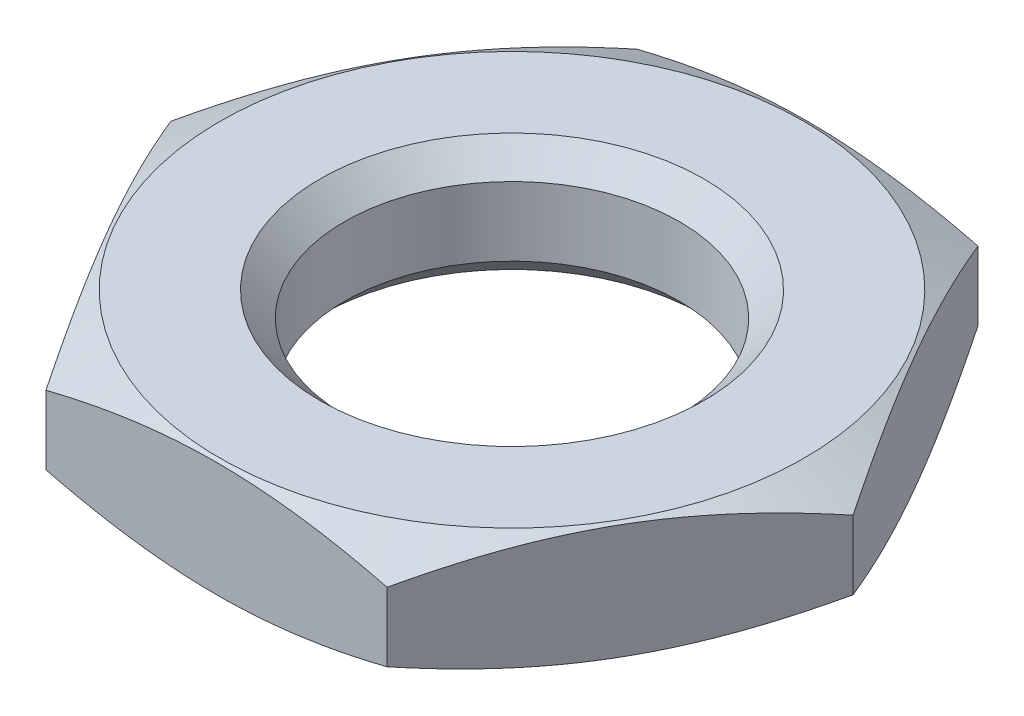
from build123d import *

# Parameters (mm, degrees)
SKETCH1_R           = 3.4
BOSS_EXTRUDE1_DEPTH = 1.2
CHAMFER1_SIZE       = 0.5


with BuildPart() as part:
    # Sketch1 → Boss-Extrude1 (new, symmetric)
    with BuildSketch(Plane(origin=(0, 0, 0), x_dir=(1, 0, 0), z_dir=(0, 1, 0))):
        Polygon((3.464101615, 6), (-3.464101615, 6), (-6.92820323, 0), (-3.464101615, -6), (3.464101615, -6), (6.92820323, 0), align=None)
        with Locations(Location((0, 0, 0), (0, 0, 270))):
            Circle(SKETCH1_R, mode=Mode.SUBTRACT)
    extrude(amount=BOSS_EXTRUDE1_DEPTH, both=True)

    # Chamfer1
    chamfer1_edges = [part.edges().sort_by_distance(p)[0] for p in [
        (0, -1.2, -3.4),
        (0, 1.2, -3.4),
    ]]
    chamfer(chamfer1_edges, length=CHAMFER1_SIZE)

    # Sketch3 → Cut-Revolve1 (revolve, cut)
    with BuildSketch(Plane.XY, mode=Mode.PRIVATE) as cut_revolve1_sk:
        Polygon((6.92820323, 1.2), (6.92820323, 0.7), (5.92820323, 1.2), align=None)
        Polygon((5.92820323, -1.2), (6.92820323, -1.2), (6.92820323, -0.7), align=None)
    revolve(cut_revolve1_sk.sketch.rotate(Axis((0, 0, 0), (0, 1, 0)), 300.000000007), axis=Axis((0, 0, 0), (0, 1, 0)), mode=Mode.SUBTRACT)


solid = part.part
